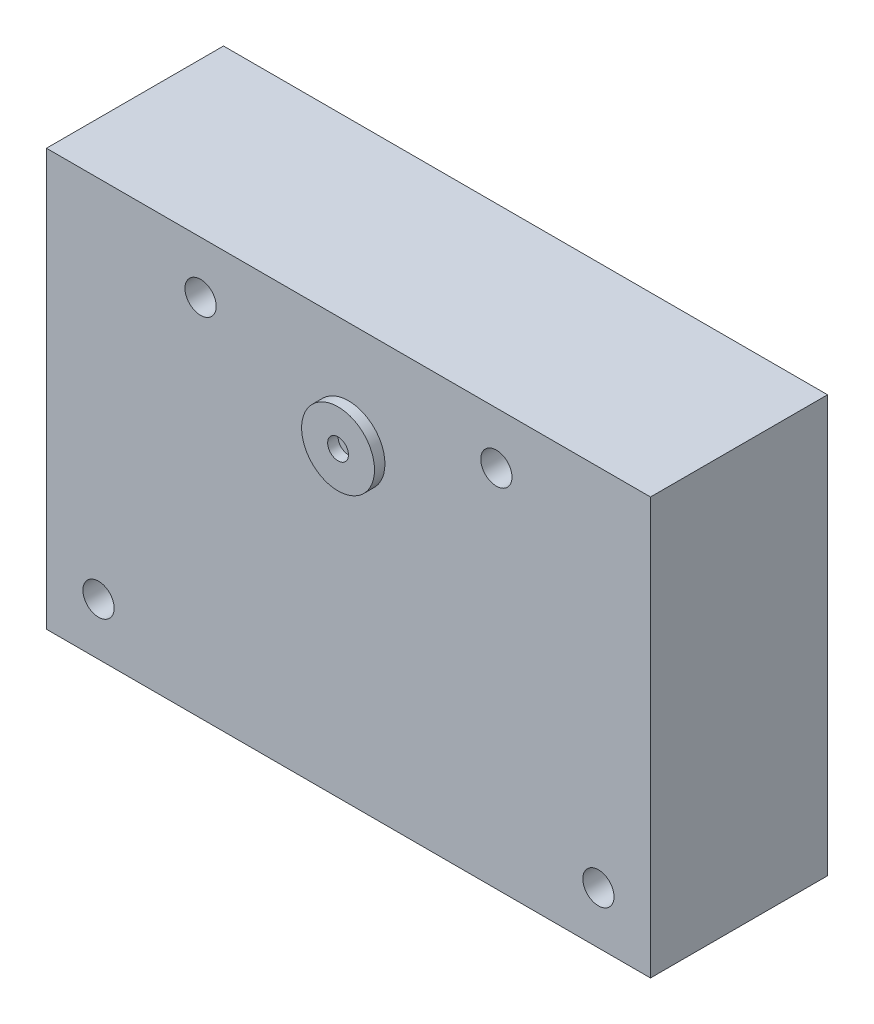
from build123d import *

# Parameters (mm, degrees)
SKETCH_1_W          = 58
SKETCH_1_H          = 40
EXTRUDE_1_DEPTH     = 17
SKETCH_2_R          = 1.5
CUT_EXTRUDE_1_DEPTH = 5
SKETCH_3_W          = 43
SKETCH_3_H          = 34
CUT_EXTRUDE_2_DEPTH = 0.5
SKETCH_4_R          = 3.5
SKETCH_4_R_2        = 1
EXTRUDE_2_DEPTH     = 1


with BuildPart() as part:
    # 草图1 → 凸台-拉伸1 (new body)
    with BuildSketch(Plane.XY):
        Rectangle(SKETCH_1_W, SKETCH_1_H)
    extrude(amount=EXTRUDE_1_DEPTH)

    # 草图2 → 切除-拉伸1 (cut)
    with BuildSketch(Plane.XY.offset(17)):
        with Locations((-24, -15)):
            Circle(SKETCH_2_R)
        with Locations((24, -15)):
            Circle(SKETCH_2_R)
        with Locations((-14.2, 15)):
            Circle(SKETCH_2_R)
        with Locations((14.2, 15)):
            Circle(SKETCH_2_R)
    extrude(amount=-CUT_EXTRUDE_1_DEPTH, mode=Mode.SUBTRACT)

    # 草图3 → 切除-拉伸2 (cut)
    with BuildSketch(Plane(origin=(0, 0, 0), x_dir=(-1, 0, 0), z_dir=(0, 0, -1))):
        with Locations((-4.5, 0)):
            Rectangle(SKETCH_3_W, SKETCH_3_H)
    extrude(amount=-CUT_EXTRUDE_2_DEPTH, mode=Mode.SUBTRACT)

    # 草图4 → 凸台-拉伸2 (add)
    with BuildSketch(Plane.XY.offset(17)):
        with Locations((0, 10)):
            Circle(SKETCH_4_R)
        with Locations((0, 10)):
            Circle(SKETCH_4_R_2, mode=Mode.SUBTRACT)
    extrude(amount=EXTRUDE_2_DEPTH)


solid = part.part
